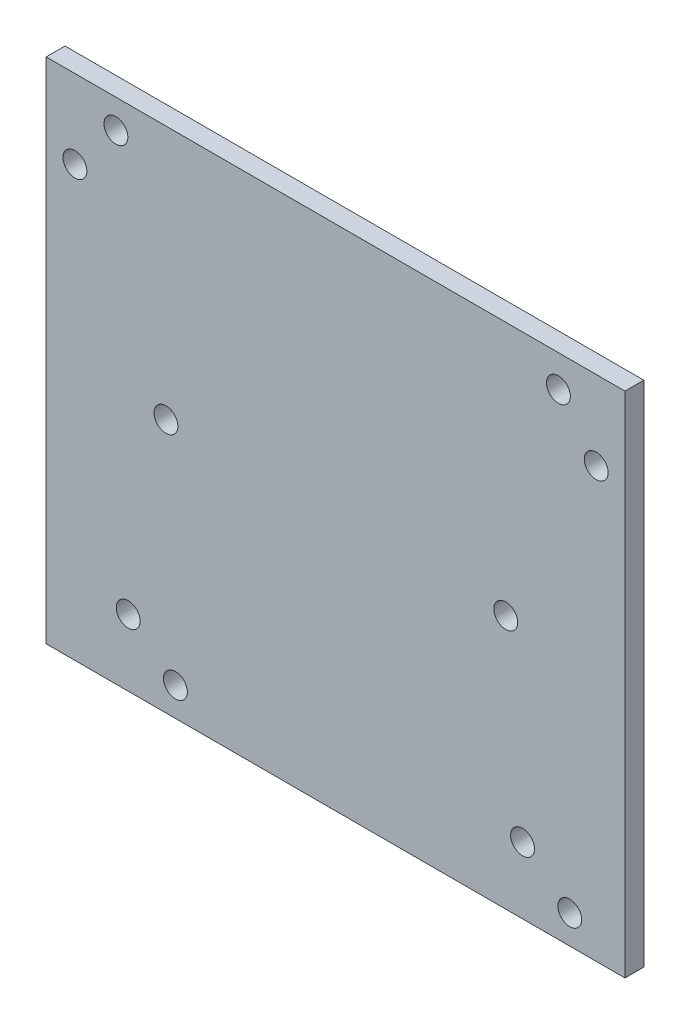
from build123d import *

# Parameters (mm, degrees)
SKETCH1_W           = 194.673052653
SKETCH1_H           = 170.954941939
SKETCH1_R           = 4.0127
BOSS_EXTRUDE1_DEPTH = 6.35


with BuildPart() as part:
    # Sketch1 → Boss-Extrude1 (new body)
    with BuildSketch(Plane.XY):
        with Locations((959.381316203, 302.755736555)):
            Rectangle(SKETCH1_W, SKETCH1_H)
        with Locations((1022.279959413, 239.653265586)):
            Circle(SKETCH1_R, mode=Mode.SUBTRACT)
        with Locations((1038.154959413, 226.953265586)):
            Circle(SKETCH1_R, mode=Mode.SUBTRACT)
        with Locations((889.644786871, 239.653265586)):
            Circle(SKETCH1_R, mode=Mode.SUBTRACT)
        with Locations((1034.333859926, 377.480941448)):
            Circle(SKETCH1_R, mode=Mode.SUBTRACT)
        with Locations((1047.042842529, 361.613131701)):
            Circle(SKETCH1_R, mode=Mode.SUBTRACT)
        with Locations((871.719789876, 361.793284425)):
            Circle(SKETCH1_R, mode=Mode.SUBTRACT)
        with Locations((885.505258454, 378.558207525)):
            Circle(SKETCH1_R, mode=Mode.SUBTRACT)
        with Locations((905.519786871, 226.953265586)):
            Circle(SKETCH1_R, mode=Mode.SUBTRACT)
        with Locations((902.338636269, 302.755736555)):
            Circle(SKETCH1_R, mode=Mode.SUBTRACT)
        with Locations(Location((1016.638636269, 302.755736555, 0), (0, 0, 180))):
            Circle(SKETCH1_R, mode=Mode.SUBTRACT)
    extrude(amount=BOSS_EXTRUDE1_DEPTH)


solid = part.part
